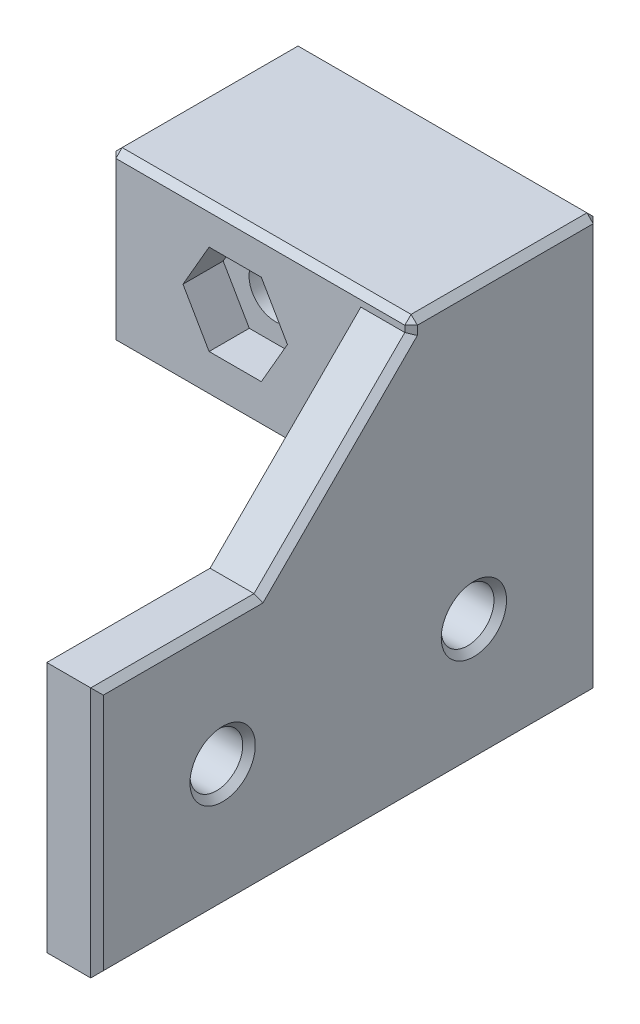
from build123d import *

# Parameters (mm, degrees)
EXTRUDE_1_DEPTH     = 15
CUT_EXTRUDE_1_DEPTH = 3.2
SKETCH_3_R          = 2.1
CUT_EXTRUDE_2_DEPTH = 38.739104388
SKETCH_1_4_W        = 4
SKETCH_1_4_H        = 20
EXTRUDE_2_DEPTH     = 40
SKETCH_4_R          = 2.1
CUT_EXTRUDE_6_DEPTH = 40
CHAMFER_1_SIZE      = 12
CUT_EXTRUDE_START   = -15
CUT_EXTRUDE_7_DEPTH = 3.2
CHAMFER_3_SIZE      = 0.5


with BuildPart() as part:
    # 草图1 → 凸台-拉伸1 (new body)
    with BuildSketch(Plane.XY):
        Polygon((-10, 33), (-10, 20), (10, 20), (14, 20), (14, 33), align=None)
    extrude(amount=EXTRUDE_1_DEPTH)

    # 草图2 → 切除-拉伸1 (cut)
    with BuildSketch(Plane.XY.offset(15)):
        Polygon((2.078460969, 22.9), (4.156921938, 26.5), (2.078460969, 30.1), (-2.078460969, 30.1), (-4.156921938, 26.5), (-2.078460969, 22.9), align=None)
    extrude(amount=-CUT_EXTRUDE_1_DEPTH, mode=Mode.SUBTRACT)

    # 草图3 → 切除-拉伸2 (cut, through all)
    with BuildSketch(Plane.XY.offset(11.8)):
        with Locations((0, 26.5)):
            Circle(SKETCH_3_R)
    extrude(amount=-CUT_EXTRUDE_2_DEPTH, mode=Mode.SUBTRACT)

    # 草图1<4> → 凸台-拉伸2 (add)
    with BuildSketch(Plane.XY):
        with Locations((12, 10)):
            Rectangle(SKETCH_1_4_W, SKETCH_1_4_H)
    extrude(amount=EXTRUDE_2_DEPTH)

    # 草图4 → 切除-拉伸6 (cut)
    with BuildSketch(Plane(origin=(14, 0, 0), x_dir=(0, 0, -1), z_dir=(1, 0, 0))):
        with Locations((-30, 10)):
            Circle(SKETCH_4_R)
        with Locations((-10, 10)):
            Circle(SKETCH_4_R)
    extrude(amount=-CUT_EXTRUDE_6_DEPTH, mode=Mode.SUBTRACT)

    # 倒角1
    chamfer_1_edges = [part.edges().sort_by_distance(p)[0] for p in [
        (12, 20, 15),
    ]]
    chamfer(chamfer_1_edges, length=CHAMFER_1_SIZE)

    # 草图2<3> → 切除-拉伸7 (cut)
    with BuildSketch(Plane.XY.offset(15).offset(CUT_EXTRUDE_START)):
        Polygon((4.156921938, 26.5), (2.078460969, 30.1), (-2.078460969, 30.1), (-4.156921938, 26.5), (-2.078460969, 22.9), (2.078460969, 22.9), align=None)
    extrude(amount=CUT_EXTRUDE_7_DEPTH, mode=Mode.SUBTRACT)

    # 倒角3
    chamfer_3_edges = [part.edges().sort_by_distance(p)[0] for p in [
        (-10, 26.5, 15),
        (-10, 20, 7.5),
        (-10, 26.5, 0),
        (2, 33, 15),
        (-10, 33, 7.5),
        (2, 33, 0),
        (14, 0, 20),
        (14, 10, 40),
        (14, 20, 33.5),
        (14, 26, 21),
        (14, 32.5, 15),
        (14, 33, 7.5),
        (14, 16.5, 0),
        (14, 10, 12.1),
        (14, 10, 32.1),
    ]]
    chamfer(chamfer_3_edges, length=CHAMFER_3_SIZE)


solid = part.part
